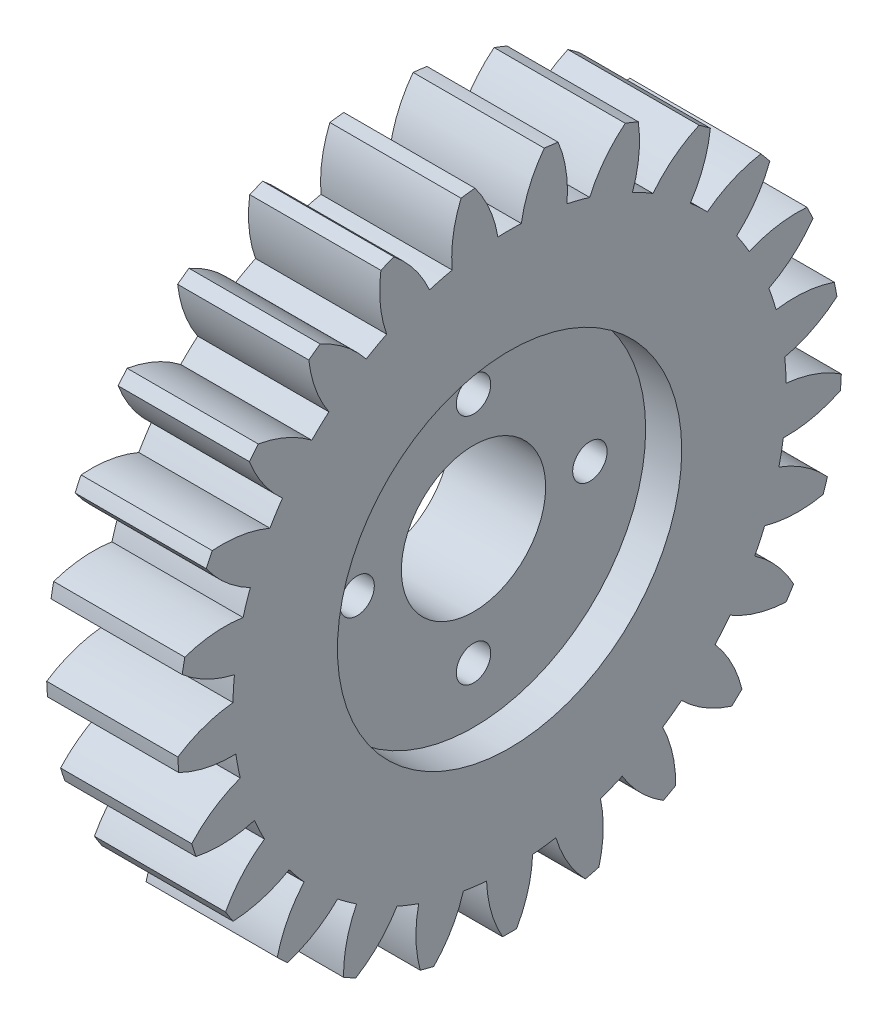
from build123d import *

# Parameters (mm, degrees)
BASPROSKE_W         = 8
BASPROSKE_H         = 20.25
TOOTHCUT_DEPTH      = 30.734239523
TEETHCUTS_COUNT     = 25
TEETHCUTS_ANGLE     = 345.6
BORSKE_R            = 0.5
BORE_DEPTH          = 50.0000508
SKETCH_1_R          = 10.5
CUT_EXTRUDE_1_DEPTH = 2.2
SKETCH_2_R          = 4.4
SKETCH_2_R_2        = 1.05
CUT_EXTRUDE_2_DEPTH = 30.207030593


with BuildPart() as part:
    # BasProSke → Base-Revolve (revolve)
    with BuildSketch(Plane(origin=(0, 0, 0), x_dir=(1, 0, 0), z_dir=(0, 1, 0))):
        with Locations((4, 10.125)):
            Rectangle(BASPROSKE_W, BASPROSKE_H)
    revolve(axis=Axis((-10, 0, 0), (1, 0, 0)))

    # TooCutSke → ToothCut (cut, through all)
    with BuildSketch(Plane(origin=(0, 0, 0), x_dir=(0, 0, -1), z_dir=(1, 0, 0))):
        with BuildLine():
            ThreePointArc((0.713909619, 16.858891098), (0, 16.874), (-0.713909619, 16.858891098))
            ThreePointArc((-0.713909619, 16.858891098), (-1.221902209, 18.597177626), (-2.131751691, 20.163022588))
            ThreePointArc((-2.131751691, 20.163022588), (0, 20.2754), (2.131751691, 20.163022588))
            ThreePointArc((2.131751691, 20.163022588), (1.221902209, 18.597177626), (0.713909619, 16.858891098))
        make_face()
    toothcut = extrude(amount=TOOTHCUT_DEPTH, mode=Mode.SUBTRACT)

    # TeethCuts: ToothCut ×25 about axis
    teethcuts_axis = Axis((-10, 0, 0), (1, 0, 0))
    for i in range(1, TEETHCUTS_COUNT):
        add(toothcut.rotate(teethcuts_axis, i * TEETHCUTS_ANGLE / (TEETHCUTS_COUNT - 1)), mode=Mode.SUBTRACT)

    # BorSke → Bore (cut, symmetric)
    with BuildSketch(Plane(origin=(0, 0, 0), x_dir=(0, 0, -1), z_dir=(1, 0, 0))):
        Circle(BORSKE_R)
    extrude(amount=BORE_DEPTH, both=True, mode=Mode.SUBTRACT)

    # 草图1 → 切除-拉伸1 (cut)
    with BuildSketch(Plane(origin=(8, 0, 0), x_dir=(0, 0, -1), z_dir=(1, 0, 0))):
        Circle(SKETCH_1_R)
    extrude(amount=-CUT_EXTRUDE_1_DEPTH, mode=Mode.SUBTRACT)

    # 草图2 → 切除-拉伸2 (cut, through all)
    with BuildSketch(Plane(origin=(5.8, 0, 0), x_dir=(0, 0, -1), z_dir=(1, 0, 0))):
        Circle(SKETCH_2_R)
        with Locations((0, 7.1)):
            Circle(SKETCH_2_R_2)
        with Locations((7.1, 0)):
            Circle(SKETCH_2_R_2)
        with Locations((0, -7.1)):
            Circle(SKETCH_2_R_2)
        with Locations((-7.1, 0)):
            Circle(SKETCH_2_R_2)
    extrude(amount=-CUT_EXTRUDE_2_DEPTH, mode=Mode.SUBTRACT)


solid = part.part
